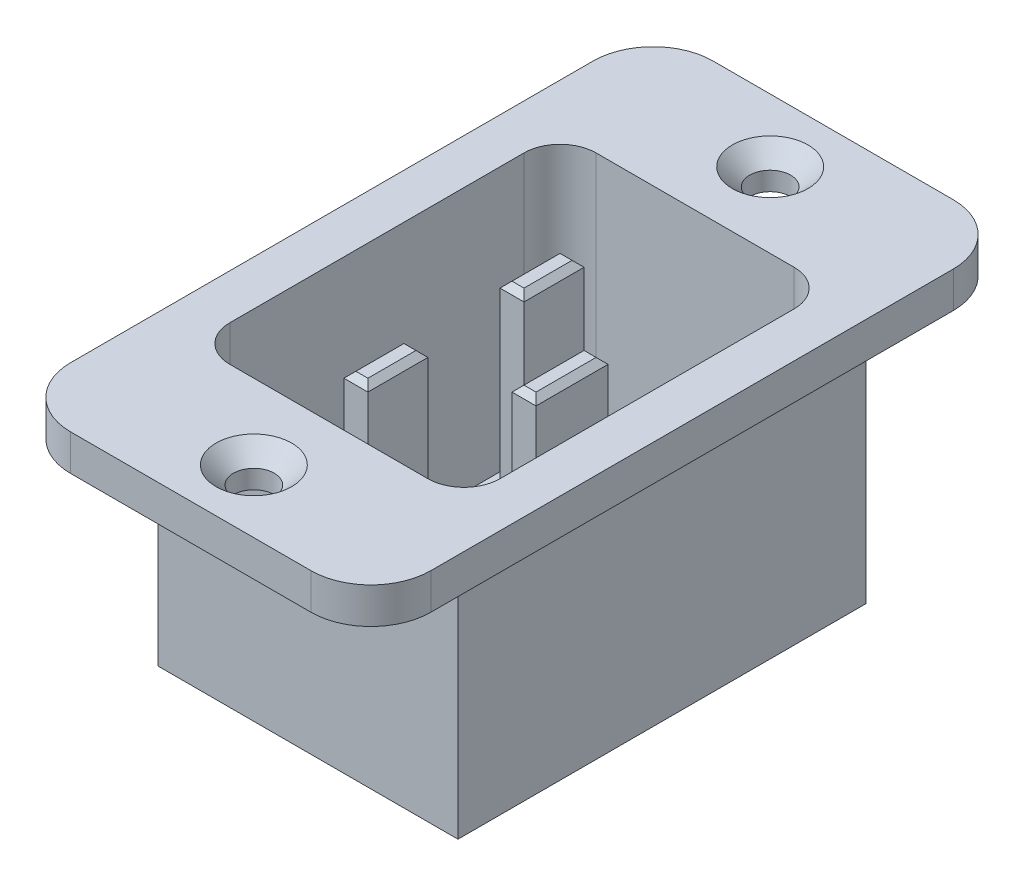
from build123d import *

# Parameters (mm, degrees)
SKETCH1_W                                       = 25
SKETCH1_H                                       = 34
BOSS_EXTRUDE1_DEPTH                             = 20
SKETCH2_W                                       = 30
SKETCH2_H                                       = 53.5
BOSS_EXTRUDE2_DEPTH                             = 3
FILLET1_R                                       = 5
SKETCH3_W                                       = 22.5
SKETCH3_H                                       = 30.5
CUT_EXTRUDE1_DEPTH                              = 22
FILLET2_R                                       = 3
SKETCH4_W                                       = 2
SKETCH4_H                                       = 6
SKETCH4_H_2                                     = 5
BOSS_EXTRUDE3_DEPTH                             = 20
CHAMFER1_SIZE                                   = 0.5
CSK_FOR_M3_FLAT_HEAD_MACHINE_SCREW1_D           = 3.4
CSK_FOR_M3_FLAT_HEAD_MACHINE_SCREW1_DEPTH       = 3
CSK_FOR_M3_FLAT_HEAD_MACHINE_SCREW1_CSINK_D     = 6.3
CSK_FOR_M3_FLAT_HEAD_MACHINE_SCREW1_CSINK_ANGLE = 90
CSK_FOR_M3_FLAT_HEAD_MACHINE_SCREW1_TIP         = 1.021463052


with BuildPart() as part:
    # Sketch1 → Boss-Extrude1 (new body)
    with BuildSketch(Plane(origin=(0, 0, 0), x_dir=(1, 0, 0), z_dir=(0, 1, 0))):
        Rectangle(SKETCH1_W, SKETCH1_H)
    extrude(amount=-BOSS_EXTRUDE1_DEPTH)

    # Sketch2 → Boss-Extrude2 (add)
    with BuildSketch(Plane(origin=(0, 0, 0), x_dir=(1, 0, 0), z_dir=(0, 1, 0))):
        Rectangle(SKETCH2_W, SKETCH2_H)
    extrude(amount=BOSS_EXTRUDE2_DEPTH)

    # Fillet1
    fillet1_edges = [part.edges().sort_by_distance(p)[0] for p in [
        (15, 1.5, 26.75),
        (15, 1.5, -26.75),
        (-15, 1.5, -26.75),
        (-15, 1.5, 26.75),
    ]]
    fillet(fillet1_edges, radius=FILLET1_R)

    # Sketch3 → Cut-Extrude1 (cut)
    with BuildSketch(Plane(origin=(0, 3, 0), x_dir=(1, 0, 0), z_dir=(0, 1, 0))):
        Rectangle(SKETCH3_W, SKETCH3_H)
    extrude(amount=-CUT_EXTRUDE1_DEPTH, mode=Mode.SUBTRACT)

    # Fillet2
    fillet2_edges = [part.edges().sort_by_distance(p)[0] for p in [
        (11.25, -8, -15.25),
        (11.25, -8, 15.25),
        (-11.25, -8, 15.25),
        (-11.25, -8, -15.25),
    ]]
    fillet(fillet2_edges, radius=FILLET2_R)

    # Sketch4 → Boss-Extrude3 (add)
    with BuildSketch(Plane(origin=(0, -19, 0), x_dir=(1, 0, 0), z_dir=(0, 1, 0))):
        with Locations((4, 0)):
            Rectangle(SKETCH4_W, SKETCH4_H)
        with Locations((-4, 6.5)):
            Rectangle(SKETCH4_W, SKETCH4_H_2)
        with Locations((-4, -6.5)):
            Rectangle(SKETCH4_W, SKETCH4_H_2)
    extrude(amount=BOSS_EXTRUDE3_DEPTH)

    # Chamfer1
    chamfer1_edges = [part.edges().sort_by_distance(p)[0] for p in [
        (-3, 1, -6.5),
        (-4, 1, -9),
        (-5, 1, -6.5),
        (-4, 1, -4),
        (-5, 1, 6.5),
        (-4, 1, 9),
        (-3, 1, 6.5),
        (-4, 1, 4),
        (5, 1, 0),
        (4, 1, -3),
        (3, 1, 0),
        (4, 1, 3),
    ]]
    chamfer(chamfer1_edges, length=CHAMFER1_SIZE)

    # CSK for M3 Flat Head Machine Screw1
    with Locations(Plane(origin=(0, 3, -21.5), x_dir=(0, 0, 1), z_dir=(0, 1, 0))):
        with Locations((0, 0), (43, 0)):
            CounterSinkHole(CSK_FOR_M3_FLAT_HEAD_MACHINE_SCREW1_D / 2, CSK_FOR_M3_FLAT_HEAD_MACHINE_SCREW1_CSINK_D / 2, depth=CSK_FOR_M3_FLAT_HEAD_MACHINE_SCREW1_DEPTH, counter_sink_angle=CSK_FOR_M3_FLAT_HEAD_MACHINE_SCREW1_CSINK_ANGLE)
            with Locations((0, 0, -(CSK_FOR_M3_FLAT_HEAD_MACHINE_SCREW1_DEPTH + CSK_FOR_M3_FLAT_HEAD_MACHINE_SCREW1_TIP / 2))):  # 118° drill point
                Cone(0, CSK_FOR_M3_FLAT_HEAD_MACHINE_SCREW1_D / 2, CSK_FOR_M3_FLAT_HEAD_MACHINE_SCREW1_TIP, mode=Mode.SUBTRACT)


solid = part.part
